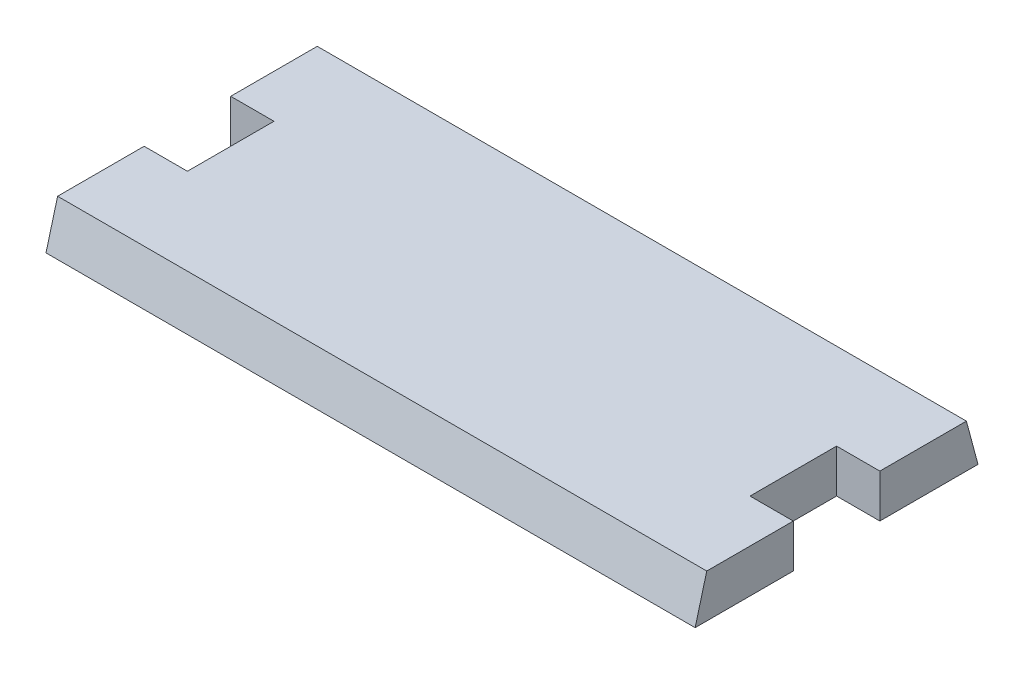
from build123d import *

# Parameters (mm, degrees)
BOSS_EXTRUDE1_DEPTH = 10
DRAFT1_ANGLE        = 15


with BuildPart() as part:
    # Sketch1 → Boss-Extrude1 (new body)
    with BuildSketch(Plane(origin=(0, 0, 0), x_dir=(1, 0, 0), z_dir=(0, 1, 0))):
        Polygon((-75, 30), (75, 30), (75, 10), (65, 10), (65, -10), (75, -10), (75, -30), (-75, -30), (-75, -10), (-65, -10), (-65, 10), (-75, 10), align=None)
    extrude(amount=BOSS_EXTRUDE1_DEPTH)

    # Draft1
    draft1_faces = [part.faces().sort_by_distance(p)[0] for p in [
        (0, 5, 30),
        (0, 5, -30),
    ]]
    draft(draft1_faces, Plane.ZX.offset(10), DRAFT1_ANGLE)


solid = part.part
